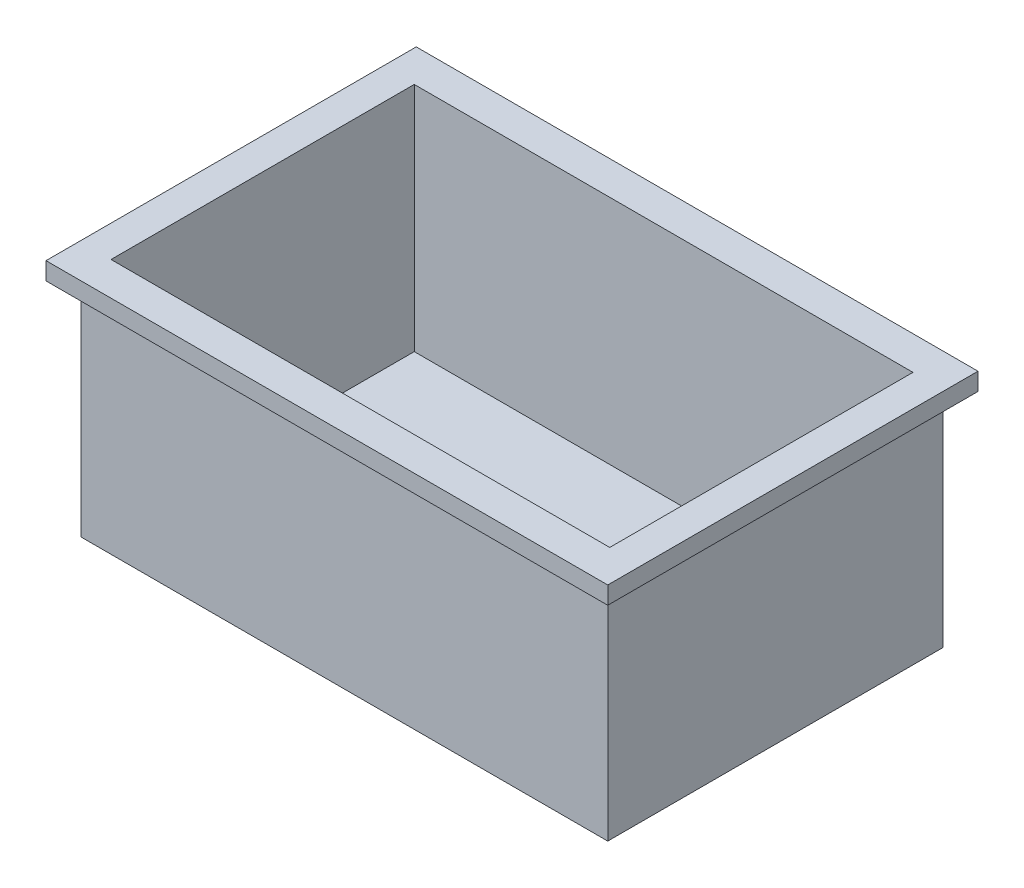
from build123d import *

# Parameters (mm, degrees)
SKETCH1_W           = 660
SKETCH1_H           = 420
SKETCH1_W_2         = 625
SKETCH1_H_2         = 380
BOSS_EXTRUDE1_DEPTH = 300
SKETCH2_W           = 625
SKETCH2_H           = 380
BOSS_EXTRUDE2_DEPTH = 10
SKETCH3_W           = 704
SKETCH3_H           = 464
SKETCH3_W_2         = 660
SKETCH3_H_2         = 420
BOSS_EXTRUDE3_DEPTH = 22


with BuildPart() as part:
    # Sketch1 → Boss-Extrude1 (new body)
    with BuildSketch(Plane(origin=(0, 0, 0), x_dir=(1, 0, 0), z_dir=(0, 1, 0))):
        Rectangle(SKETCH1_W, SKETCH1_H)
        Rectangle(SKETCH1_W_2, SKETCH1_H_2, mode=Mode.SUBTRACT)
    extrude(amount=BOSS_EXTRUDE1_DEPTH)

    # Sketch3 → Boss-Extrude3 (add)
    with BuildSketch(Plane(origin=(0, 300, 0), x_dir=(1, 0, 0), z_dir=(0, 1, 0))):
        Rectangle(SKETCH3_W, SKETCH3_H)
        Rectangle(SKETCH3_W_2, SKETCH3_H_2, mode=Mode.SUBTRACT)
    extrude(amount=-BOSS_EXTRUDE3_DEPTH)


with BuildPart() as body_2:
    # Sketch2 → Boss-Extrude2 (new body)
    with BuildSketch(Plane.XZ):
        Rectangle(SKETCH2_W, SKETCH2_H)
    extrude(amount=-BOSS_EXTRUDE2_DEPTH)


solid = Compound([part.part, body_2.part])
